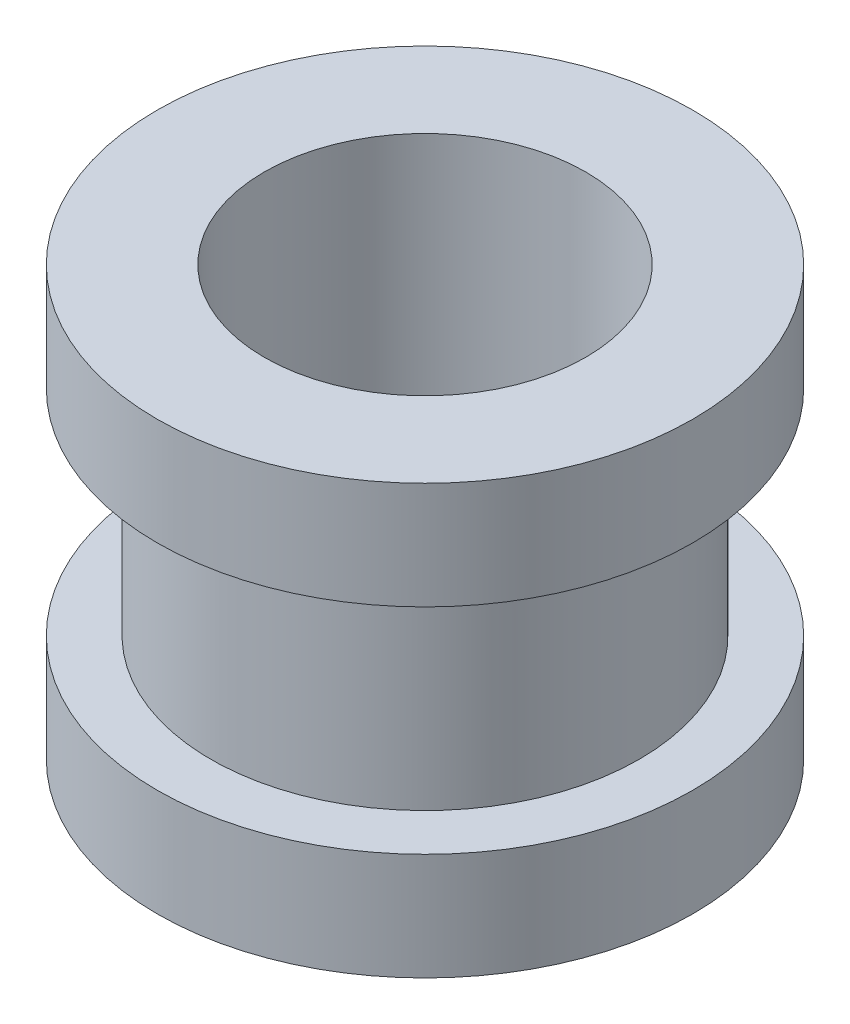
from build123d import *

# Parameters (mm, degrees)
SKETCH2_R          = 1.5
CUT_EXTRUDE1_DEPTH = 6.338539126


with BuildPart() as part:
    # Sketch1 → Revolve1 (revolve)
    with BuildSketch(Plane.XY):
        Polygon((0, 2), (0, 0), (-2, 0), (-2, 1), (-2.5, 1), (-2.5, 2), align=None)
    revolve1 = revolve(axis=Axis((0, 2, 0), (0, -1, 0)))

    # Mirror1: Revolve1 across plane
    add(revolve1.mirror(Plane(origin=(-2, 0, 0), x_dir=(0, 0, 1), z_dir=(0, -1, 0))))

    # Sketch2 → Cut-Extrude1 (cut, through all)
    with BuildSketch(Plane(origin=(0, 2, 0), x_dir=(1, 0, 0), z_dir=(0, 1, 0))):
        with Locations(Location((0, 0, 0), (0, 0, 180))):
            Circle(SKETCH2_R)
    extrude(amount=-CUT_EXTRUDE1_DEPTH, mode=Mode.SUBTRACT)


solid = part.part
